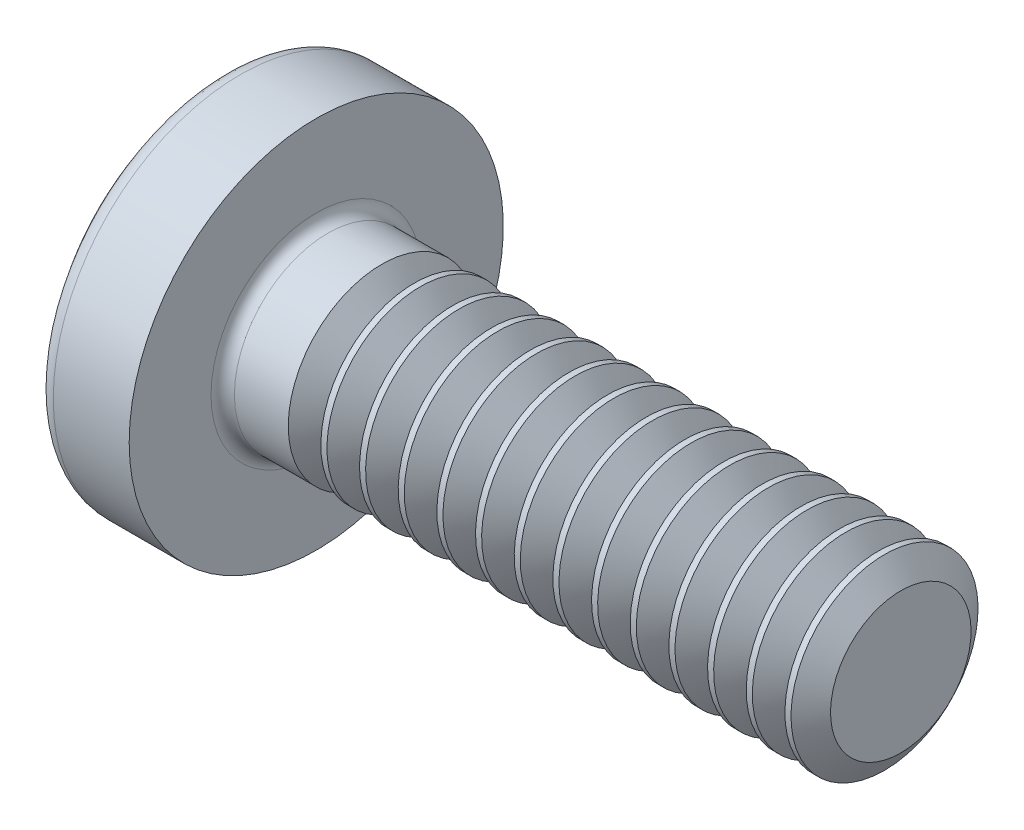
from build123d import *

# Parameters (mm, degrees)
FILLET1_R       = 0.1
RECPAT_COUNT    = 2
RECPAT_ANGLE    = 90
THDSCHPAT_COUNT = 14
THDSCHPAT_PITCH = 0.330769231


with BuildPart() as part:
    # BodySke → Base-Revolve (revolve)
    with BuildSketch(Plane.XY, mode=Mode.PRIVATE) as base_revolve_sk:
        with BuildLine():
            Line((1.3, 0.8), (1.3, 1.6))
            Line((1.3, 1.6), (0.650675799, 1.6))
            ThreePointArc((0.650675799, 1.6), (0.585036553, 1.584875829), (0.532633829, 1.542553191))
            ThreePointArc((0.532633829, 1.542553191), (0.136907172, 0.815960959), (0, 0))
            Line((0, 0), (6.3, 0))
            Line((6.3, 0), (6.3, 0.8))
            Line((6.3, 0.8), (1.3, 0.8))
        make_face()
    revolve(base_revolve_sk.sketch.rotate(Axis((0.650675799, 0, 0), (1, 0, 0)), 90), axis=Axis((0.650675799, 0, 0), (1, 0, 0)))

    # Fillet1
    fillet1_edges = [part.edges().sort_by_distance(p)[0] for p in [
        (1.3, 0, -0.8),
    ]]
    fillet(fillet1_edges, radius=FILLET1_R)

    # Sketch3 → Recess section 0
    with BuildSketch(Plane(origin=(0, 0, 0), x_dir=(0, 0, -1), z_dir=(1, 0, 0))):
        with BuildLine():
            Line((0.24, -0.8), (-0.24, -0.8))
            Line((-0.24, -0.8), (-0.24, 0.8))
            Line((-0.24, 0.8), (0.24, 0.8))
            Line((0.24, 0.8), (0.24, -0.8))
        make_face()
    # Sketch4 → Recess section 1
    with BuildSketch(Plane(origin=(0.9, 0, 0), x_dir=(0, 0, -1), z_dir=(1, 0, 0))):
        with BuildLine():
            Line((0.24, -0.351276628), (-0.24, -0.351276628))
            Line((-0.24, -0.351276628), (-0.24, 0.351276628))
            Line((-0.24, 0.351276628), (0.24, 0.351276628))
            Line((0.24, 0.351276628), (0.24, -0.351276628))
        make_face()
    recess = loft(mode=Mode.SUBTRACT)

    # RecPat: Recess ×2 about axis
    recpat_axis = Axis((0, 0, 0), (1, 0, 0))
    for i in range(1, RECPAT_COUNT):
        add(recess.rotate(recpat_axis, i * RECPAT_ANGLE / (RECPAT_COUNT - 1)), mode=Mode.SUBTRACT)

    # RecCorSke → RecessCore (revolve, cut)
    with BuildSketch(Plane.XY, mode=Mode.PRIVATE) as recesscore_sk:
        Polygon((0, 0), (0, 0.418434131), (0.9, 0.3555), (1.015508952, 0), align=None)
    revolve(recesscore_sk.sketch.rotate(Axis((-3.175, 0, 0), (1, 0, 0)), 18.006283694), axis=Axis((-3.175, 0, 0), (1, 0, 0)), mode=Mode.SUBTRACT)

    # ThdSchSke → ThreadSchematic (revolve, cut)
    with BuildSketch(Plane.XY, mode=Mode.PRIVATE) as threadschematic_sk:
        Polygon((2, -0.601), (1.8606587, -0.8), (1.8606587, -1), (2.1393413, -1), (2.1393413, -0.8), align=None)
    threadschematic = revolve(threadschematic_sk.sketch.rotate(Axis((-3.175, 0, 0), (1, 0, 0)), 270), axis=Axis((-3.175, 0, 0), (1, 0, 0)), mode=Mode.SUBTRACT)

    # ThdSchPat: ThreadSchematic ×14
    with Locations(*[(i * THDSCHPAT_PITCH, 0, 0) for i in range(1, THDSCHPAT_COUNT)]):
        add(threadschematic, mode=Mode.SUBTRACT)


solid = part.part
